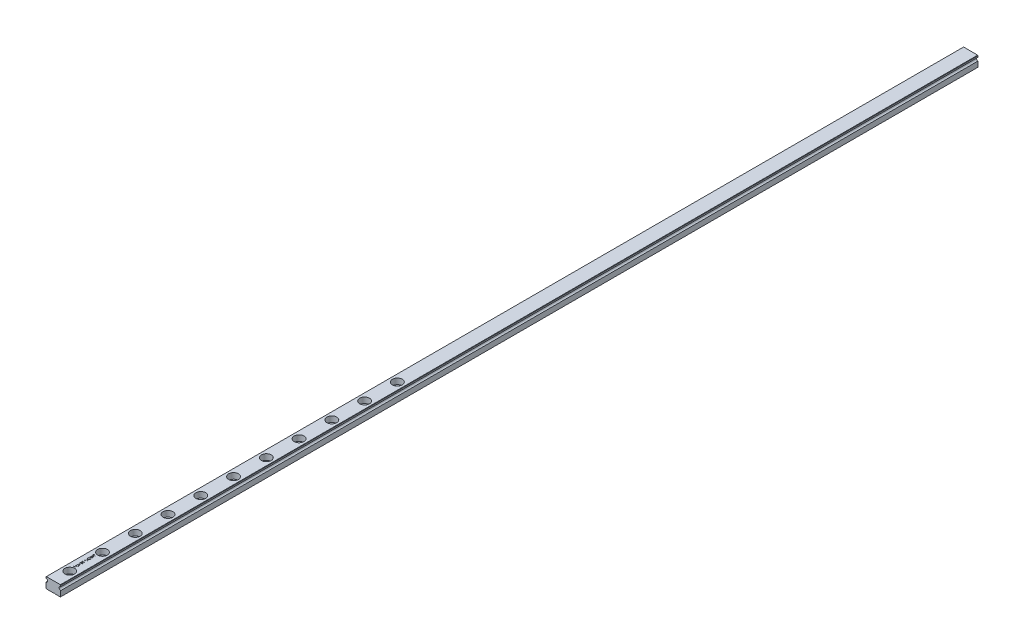
from build123d import *

# Parameters (mm, degrees)
EXTRUDE_1_DEPTH              = 220
HOLE_WIZARD_M3_1_D           = 3.5
HOLE_WIZARD_M3_1_CBORE_D     = 6
HOLE_WIZARD_M3_1_CBORE_DEPTH = 3.5
PATTERN_LINEAR_1_COUNT       = 11
PATTERN_LINEAR_1_PITCH       = 20
SKETCH_6_W                   = 1.5
SKETCH_6_H                   = 0.134615385
CUT_EXTRUDE_1_DEPTH          = 0.1
EXTRUDE_2_DEPTH              = 340


with BuildPart() as part:
    # 草图1 → 凸台-拉伸1 (new body)
    with BuildSketch(Plane.XY):
        with BuildLine():
            Line((4.5, 5.5), (4.5, 6.3))
            Line((4.5, 6.3), (4.3, 6.5))
            Line((4.3, 6.5), (-4.3, 6.5))
            Line((-4.3, 6.5), (-4.5, 6.3))
            Line((-4.5, 6.3), (-4.5, 5.5))
            ThreePointArc((-4.5, 5.5), (-3.5, 4.5), (-4.5, 3.5))
            Line((-4.5, 3.5), (-4.5, 0.2))
            Line((-4.5, 0.2), (-4.3, 0))
            Line((-4.3, 0), (0.2, 0))
            ThreePointArc((0.2, 0), (0.5, 0.3), (0.8, 0))
            Line((0.8, 0), (4.3, 0))
            Line((4.3, 0), (4.5, 0.2))
            Line((4.5, 0.2), (4.5, 3.5))
            ThreePointArc((4.5, 3.5), (3.5, 4.5), (4.5, 5.5))
        make_face()
    extrude(amount=-EXTRUDE_1_DEPTH)

    # M3 六角凹头螺钉的柱形沉头孔1 (through all)
    with Locations(Plane(origin=(0.754900713, 6.5, 19.343475793), x_dir=(-1, 0, 0), z_dir=(0, 1, 0))):
        with Locations((0.754900713, -29.343475793)):
            hole_wizard_m3_1 = CounterBoreHole(HOLE_WIZARD_M3_1_D / 2, HOLE_WIZARD_M3_1_CBORE_D / 2, HOLE_WIZARD_M3_1_CBORE_DEPTH)

    # 阵列(线性)1: M3 六角凹头螺钉的柱形沉头孔1 ×11
    with Locations(*[(0, 0, -i * PATTERN_LINEAR_1_PITCH) for i in range(1, PATTERN_LINEAR_1_COUNT)]):
        add(hole_wizard_m3_1, mode=Mode.SUBTRACT)

    # 草图6 → 切除-拉伸1 (cut)
    # profile 1 of 9: a face of its own
    with BuildSketch(Plane(origin=(0, 6.5, 0), x_dir=(1, 0, 0), z_dir=(0, 1, 0))):
        Polygon((-1.5, 13.740384615), (-1.5, 13.875), (-0.884615385, 13.875), (-0.884615385, 14.644230769), (-1.5, 14.644230769), (-1.5, 14.778846154), (0, 14.778846154), (0, 14.644230769), (-0.730769231, 14.644230769), (-0.730769231, 13.875), (0, 13.875), (0, 13.740384615), align=None)
    # profile 2 of 9: a face of its own
    with BuildSketch(Plane(origin=(0, 6.5, 0), x_dir=(1, 0, 0), z_dir=(0, 1, 0))):
        with Locations((-0.75, 15.230769231)):
            Rectangle(SKETCH_6_W, SKETCH_6_H)
    # profile 3 of 9: a face of its own
    with BuildSketch(Plane(origin=(0, 6.5, 0), x_dir=(1, 0, 0), z_dir=(0, 1, 0))):
        Polygon((-1.5, 15.528846154), (-1.5, 15.66796875), (-0.399939904, 15.961538462), (-1.5, 16.398137019), (-1.5, 16.417668269), (-0.407451923, 16.846153846), (-1.5, 17.141225962), (-1.5, 17.278846154), (0, 16.874399038), (0, 16.855168269), (-1.147235577, 16.403846154), (0, 15.947115385), (0, 15.927884615), align=None)
    # profile 4 of 9: a face of its own
    with BuildSketch(Plane(origin=(0, 6.5, 0), x_dir=(1, 0, 0), z_dir=(0, 1, 0))):
        with Locations((-0.75, 17.692307693)):
            Rectangle(SKETCH_6_W, SKETCH_6_H)
    # profile 5 of 9: a face of its own
    with BuildSketch(Plane(origin=(0, 6.5, 0), x_dir=(1, 0, 0), z_dir=(0, 1, 0))):
        Polygon((0, 18.086538462), (-1.5, 18.086538462), (-1.5, 18.114783654), (-0.319411058, 19.105769231), (-1.5, 19.105769231), (-1.5, 19.240384615), (0, 19.240384615), (0, 19.209735577), (-1.177884615, 18.221153846), (0, 18.221153846), align=None)
    # profile 6 of 9: a face of its own
    with BuildSketch(Plane(origin=(0, 6.5, 0), x_dir=(1, 0, 0), z_dir=(0, 1, 0))):
        Polygon((0, 20.125), (-1.5, 20.323016827), (-1.5, 20.342247596), (-0.269230769, 20.961538462), (-1.5, 21.579326923), (-1.5, 21.598858173), (0, 21.798076923), (0, 21.662860577), (-1.079326923, 21.519230769), (0, 20.977764423), (0, 20.947415865), (-1.081730769, 20.403846154), (0, 20.260516827), align=None)
    # profile 7 of 9: a face of its own
    with BuildSketch(Plane(origin=(0, 6.5, 0), x_dir=(1, 0, 0), z_dir=(0, 1, 0))):
        with BuildLine():
            Line((-1.243990385, 23.509615385), (-1.134615385, 23.394230769))
            add(Edge.make_bspline(
                [(-1.134615385, 23.394230769), (-1.154263766, 23.373355449), (-1.193092001, 23.332102593), (-1.243390317, 23.264731189), (-1.28690443, 23.194721537), (-1.322045397, 23.121960438), (-1.349611823, 23.048355866), (-1.369650093, 22.975173457), (-1.382340162, 22.902887044), (-1.383864341, 22.854816629), (-1.384615385, 22.831129808)],
                knots=[0, 0, 0, 0, 1.089067066, 2.152164705, 3.18986567, 4.218445106, 5.218487318, 6.173592265, 7.100032889, 8, 8, 8, 8], degree=3))
            add(Edge.make_bspline(
                [(-1.384615385, 22.831129808), (-1.384438125, 22.816594936), (-1.384084065, 22.78756289), (-1.379565116, 22.7444392), (-1.373065889, 22.701767784), (-1.363662227, 22.659629195), (-1.351744059, 22.6179415), (-1.336836002, 22.576849691), (-1.319455188, 22.536277104), (-1.299371251, 22.496605953), (-1.277308532, 22.458145638), (-1.252858892, 22.42182164), (-1.226807524, 22.387400299), (-1.198496406, 22.355536353), (-1.168203133, 22.326017847), (-1.136473262, 22.298301833), (-1.102682945, 22.272904871), (-1.066971137, 22.250282454), (-1.030168657, 22.229853485), (-0.992587626, 22.212199685), (-0.954576919, 22.196852561), (-0.915850319, 22.185163721), (-0.876807084, 22.175263346), (-0.837242608, 22.168371388), (-0.797053572, 22.164472967), (-0.770140273, 22.163799899), (-0.756610577, 22.163461538)],
                knots=[0, 0, 0, 0, 1.028150113, 2.053633673, 3.06513288, 4.081487945, 5.106702018, 6.131327874, 7.172780699, 8.228344599, 9.276313556, 10.308389736, 11.324843658, 12.329040066, 13.321460474, 14.316307835, 15.308626991, 16.309440696, 17.305625405, 18.28535951, 19.246194545, 20.203493668, 21.145557131, 22.095268976, 23.042464743, 24, 24, 24, 24], degree=3))
            add(Edge.make_bspline(
                [(-0.756610577, 22.163461538), (-0.742780294, 22.163785622), (-0.715157493, 22.164432905), (-0.673930463, 22.168569989), (-0.633320499, 22.176265079), (-0.593263727, 22.186470115), (-0.553680426, 22.199444118), (-0.514611904, 22.215383767), (-0.476061961, 22.23437211), (-0.438413282, 22.256302653), (-0.401770368, 22.280520997), (-0.36696502, 22.307157219), (-0.334402283, 22.336256163), (-0.303606537, 22.367284281), (-0.274772132, 22.40052428), (-0.248246624, 22.43629865), (-0.223619847, 22.474106619), (-0.201162346, 22.513964957), (-0.181102046, 22.555452377), (-0.163263098, 22.597990847), (-0.14857199, 22.641717091), (-0.136598507, 22.686401091), (-0.126784097, 22.731989638), (-0.120470176, 22.778714125), (-0.115888391, 22.826231), (-0.11555339, 22.858261842), (-0.115384615, 22.874399038)],
                knots=[0, 0, 0, 0, 0.935915162, 1.869274651, 2.799799983, 3.730201895, 4.664668062, 5.616159355, 6.583070886, 7.570012957, 8.562524459, 9.553461134, 10.53281078, 11.515274572, 12.509912756, 13.507571325, 14.526460018, 15.561318395, 16.601025881, 17.643204557, 18.680545676, 19.719612342, 20.772381578, 21.833430283, 22.908478249, 24, 24, 24, 24], degree=3))
            add(Edge.make_bspline(
                [(-0.115384615, 22.874399038), (-0.11579098, 22.893846981), (-0.116588941, 22.932036175), (-0.122805743, 22.988172098), (-0.132502802, 23.042091792), (-0.14674811, 23.093619722), (-0.164779159, 23.142942891), (-0.187077122, 23.189879386), (-0.213407387, 23.234558812), (-0.24323677, 23.276787781), (-0.276471827, 23.315562361), (-0.312015273, 23.350851823), (-0.350327601, 23.381442662), (-0.390837822, 23.408248655), (-0.433933425, 23.430404616), (-0.479374666, 23.448595707), (-0.527189663, 23.462538188), (-0.560228886, 23.468261798), (-0.576923077, 23.471153846)],
                knots=[0, 0, 0, 0, 1.130199668, 2.219330667, 3.279027493, 4.311506524, 5.322739849, 6.327972234, 7.327472899, 8.33386792, 9.329086447, 10.29244429, 11.240784345, 12.174119183, 13.111530729, 14.052100829, 15.015757696, 16, 16, 16, 16], degree=3))
            Line((-0.576923077, 23.471153846), (-0.576923077, 22.971153846))
            Line((-0.576923077, 22.971153846), (-0.730769231, 22.971153846))
            Line((-0.730769231, 22.971153846), (-0.730769231, 23.605769231))
            add(Edge.make_bspline(
                [(-0.730769231, 23.605769231), (-0.702094593, 23.605038153), (-0.645973146, 23.603607301), (-0.564128744, 23.593570623), (-0.48682659, 23.577363547), (-0.413985274, 23.555223413), (-0.34570802, 23.526562579), (-0.281925506, 23.491688638), (-0.223049785, 23.450043443), (-0.168600212, 23.403110397), (-0.12003055, 23.350438986), (-0.077342291, 23.293452435), (-0.041384027, 23.232056591), (-0.012129457, 23.166309531), (0.010702255, 23.096426488), (0.026890073, 23.022245754), (0.036588629, 22.943867925), (0.037827792, 22.890152206), (0.038461538, 22.862680288)],
                knots=[0, 0, 0, 0, 1.140356446, 2.231883559, 3.274166699, 4.278491846, 5.25512956, 6.21435461, 7.1637429, 8.11826594, 9.068280886, 10.0076534, 10.945064095, 11.891975133, 12.864533718, 13.863980011, 14.907571808, 16, 16, 16, 16], degree=3))
            add(Edge.make_bspline(
                [(0.038461538, 22.862680288), (0.038217629, 22.845747373), (0.037736562, 22.812350207), (0.034317699, 22.763025524), (0.029054595, 22.715060829), (0.021106685, 22.668463111), (0.011371833, 22.623060964), (-0.001093904, 22.579081142), (-0.015523346, 22.53635611), (-0.031935778, 22.494819831), (-0.050952202, 22.45484931), (-0.072084905, 22.416266517), (-0.095224917, 22.378858178), (-0.120772422, 22.342879107), (-0.148536333, 22.308141841), (-0.178572299, 22.274870365), (-0.210788493, 22.242878417), (-0.233665211, 22.222838219), (-0.245192308, 22.212740385)],
                knots=[0, 0, 0, 0, 1.107784379, 2.184907829, 3.233506516, 4.263428166, 5.276301166, 6.270063455, 7.25232949, 8.225834625, 9.190232166, 10.146266622, 11.1027726, 12.066435141, 13.031522626, 14.010570082, 14.99756817, 16, 16, 16, 16], degree=3))
            add(Edge.make_bspline(
                [(-0.245192308, 22.212740385), (-0.26347973, 22.198089271), (-0.299751023, 22.169030237), (-0.357865285, 22.131625313), (-0.418037511, 22.099738997), (-0.480435209, 22.073867073), (-0.545000015, 22.053665036), (-0.611649425, 22.039176642), (-0.680469267, 22.030687804), (-0.727040094, 22.02946486), (-0.750600962, 22.028846154)],
                knots=[0, 0, 0, 0, 1.023165419, 2.029347347, 3.013907458, 3.994755782, 4.975994455, 5.96558838, 6.970761222, 8, 8, 8, 8], degree=3))
            add(Edge.make_bspline(
                [(-0.750600962, 22.028846154), (-0.768243641, 22.029074256), (-0.803304773, 22.029527561), (-0.855357904, 22.035024211), (-0.906486775, 22.042910531), (-0.956649576, 22.054502135), (-1.005879862, 22.069114786), (-1.054200296, 22.087352121), (-1.101640133, 22.108585168), (-1.147870041, 22.133266476), (-1.192287019, 22.160724506), (-1.234673706, 22.190556358), (-1.274343142, 22.222992223), (-1.311387223, 22.258126549), (-1.346354989, 22.295251091), (-1.378516018, 22.33514522), (-1.408373576, 22.377204507), (-1.435353952, 22.421754996), (-1.459597318, 22.468093695), (-1.480849352, 22.516119874), (-1.498413761, 22.565816082), (-1.513316774, 22.616810749), (-1.524337558, 22.669489669), (-1.532329875, 22.723470616), (-1.537798704, 22.779034949), (-1.538238528, 22.816593247), (-1.538461538, 22.835637019)],
                knots=[0, 0, 0, 0, 1.00895651, 2.005089799, 2.991467152, 3.967318338, 4.948153826, 5.927364234, 6.919980553, 7.91976625, 8.923240147, 9.905815003, 10.88314567, 11.851989312, 12.825009789, 13.798721852, 14.781296708, 15.773896486, 16.776076962, 17.771600213, 18.775744723, 19.78957137, 20.808953803, 21.851964491, 22.910847925, 24, 24, 24, 24], degree=3))
            add(Edge.make_bspline(
                [(-1.538461538, 22.835637019), (-1.538213185, 22.851167695), (-1.537720729, 22.8819632), (-1.534307308, 22.927788514), (-1.528897073, 22.97290552), (-1.521514165, 23.017381116), (-1.511458298, 23.061063844), (-1.499424747, 23.104078147), (-1.485413966, 23.146486377), (-1.46870446, 23.188155626), (-1.449738621, 23.229366076), (-1.428390011, 23.270346865), (-1.404293581, 23.31095797), (-1.37737778, 23.351269819), (-1.348104887, 23.391536616), (-1.315637676, 23.431121462), (-1.281256495, 23.470979867), (-1.256535559, 23.496609216), (-1.243990385, 23.509615385)],
                knots=[0, 0, 0, 0, 0.985871117, 1.954866573, 2.915460327, 3.869826059, 4.81536089, 5.759505086, 6.70452669, 7.649098992, 8.607881297, 9.583363685, 10.581137262, 11.603961102, 12.659522466, 13.73993555, 14.853081303, 16, 16, 16, 16], degree=3))
        make_face()
    # profile 8 of 9: a face of its own
    with BuildSketch(Plane(origin=(0, 6.5, 0), x_dir=(1, 0, 0), z_dir=(0, 1, 0))):
        Polygon((0, 23.913461538), (-1.5, 23.913461538), (-1.5, 23.941706731), (-0.319411058, 24.932692308), (-1.5, 24.932692308), (-1.5, 25.067307692), (0, 25.067307692), (0, 25.036658654), (-1.177884615, 24.048076923), (0, 24.048076923), align=None)
    # profile 9 of 9: a face of its own
    with BuildSketch(Plane(origin=(0, 6.5, 0), x_dir=(1, 0, 0), z_dir=(0, 1, 0))):
        with BuildLine():
            Line((0.038461538, 25.644230769), (-0.036358173, 25.536658654))
            Line((-0.036358173, 25.536658654), (-0.646033654, 25.953725962))
            add(Edge.make_bspline(
                [(-0.646033654, 25.953725962), (-0.642627639, 25.927119325), (-0.635922786, 25.874743285), (-0.635046516, 25.821948826), (-0.634615385, 25.795973558)],
                knots=[0, 0, 0, 0, 1.015985029, 2, 2, 2, 2], degree=3))
            add(Edge.make_bspline(
                [(-0.634615385, 25.795973558), (-0.635018703, 25.780226966), (-0.635810382, 25.749317783), (-0.642085443, 25.703875646), (-0.651749784, 25.660210407), (-0.666170676, 25.61843782), (-0.684092777, 25.578400913), (-0.706317169, 25.540186946), (-0.732462883, 25.503847908), (-0.762390698, 25.469771994), (-0.79525498, 25.438786105), (-0.830027824, 25.411158608), (-0.867084601, 25.38832306), (-0.905643777, 25.369014905), (-0.946528356, 25.354782526), (-0.989044603, 25.344167996), (-1.033456433, 25.33770465), (-1.063680548, 25.336931181), (-1.079026442, 25.336538462)],
                knots=[0, 0, 0, 0, 1.060698949, 2.082059282, 3.085738422, 4.069684654, 5.054463875, 6.037298355, 7.043153692, 8.066652628, 9.088369706, 10.083456696, 11.053578809, 12.016466116, 12.983507685, 13.964045196, 14.966270913, 16, 16, 16, 16], degree=3))
            add(Edge.make_bspline(
                [(-1.079026442, 25.336538462), (-1.100012199, 25.337283285), (-1.141202981, 25.338745222), (-1.201400397, 25.350466182), (-1.258351131, 25.369885651), (-1.3119915, 25.396537862), (-1.361089385, 25.43075081), (-1.405478439, 25.47138122), (-1.444366827, 25.518757479), (-1.477757084, 25.571642671), (-1.504794475, 25.628718475), (-1.524003389, 25.688742519), (-1.536274492, 25.750703662), (-1.537729379, 25.792811829), (-1.538461538, 25.814002404)],
                knots=[0, 0, 0, 0, 1.023011052, 2.007963168, 2.978169221, 3.950402619, 4.919353283, 5.887490769, 6.876420893, 7.899700203, 8.931203047, 9.947778163, 10.96723692, 12, 12, 12, 12], degree=3))
            add(Edge.make_bspline(
                [(-1.538461538, 25.814002404), (-1.537677179, 25.834783148), (-1.536127357, 25.875843941), (-1.524777147, 25.936225043), (-1.505646911, 25.994056533), (-1.479211547, 26.04902008), (-1.446070758, 26.099903164), (-1.406596454, 26.145683388), (-1.360755672, 26.185145911), (-1.309807647, 26.21879079), (-1.25472961, 26.245295182), (-1.197347446, 26.264716171), (-1.138006313, 26.276587527), (-1.097810064, 26.2780886), (-1.077524038, 26.278846154)],
                knots=[0, 0, 0, 0, 1.026358223, 2.027987109, 3.023239252, 4.028077889, 5.032770297, 6.015020143, 7.004250571, 8.011656937, 9.02310243, 10.015224881, 10.998334443, 12, 12, 12, 12], degree=3))
            add(Edge.make_bspline(
                [(-1.077524038, 26.278846154), (-1.061777289, 26.278338872), (-1.029838946, 26.277309978), (-0.981399024, 26.270187018), (-0.932048608, 26.257900384), (-0.890237555, 26.244171772), (-0.855599349, 26.230715419), (-0.828157364, 26.218414328), (-0.799474135, 26.204124912), (-0.769432207, 26.188166246), (-0.737992383, 26.170568563), (-0.705372722, 26.150853478), (-0.671525668, 26.129286907), (-0.648704972, 26.113932306), (-0.637019231, 26.106069712)],
                knots=[0, 0, 0, 0, 1.179894106, 2.393120058, 3.660107319, 4.986885617, 5.687958251, 6.443931318, 7.239444731, 8.088894906, 8.992865148, 9.938946712, 10.944601238, 12, 12, 12, 12], degree=3))
            Line((-0.637019231, 26.106069712), (0.038461538, 25.644230769))
        make_face()
        with BuildLine():
            add(Edge.make_bspline(
                [(-0.788461538, 25.820913462), (-0.788788092, 25.832842038), (-0.789423782, 25.856062922), (-0.793275522, 25.890085737), (-0.800155229, 25.922181807), (-0.809870336, 25.952557703), (-0.822177437, 25.981176653), (-0.837175655, 26.008047671), (-0.855193568, 26.032896281), (-0.875446063, 26.05581095), (-0.897641992, 26.076606708), (-0.92142287, 26.094537445), (-0.946049906, 26.110062218), (-0.972027251, 26.122447516), (-0.998929945, 26.132428799), (-1.027147055, 26.139393389), (-1.056483756, 26.143240028), (-1.076411522, 26.143896939), (-1.086538462, 26.144230769)],
                knots=[0, 0, 0, 0, 1.163726718, 2.265380301, 3.334713825, 4.36057981, 5.371541381, 6.368955992, 7.355979581, 8.359691305, 9.348261197, 10.317521986, 11.261029684, 12.183096459, 13.119698615, 14.055740009, 15.011961376, 16, 16, 16, 16], degree=3))
            add(Edge.make_bspline(
                [(-1.086538462, 26.144230769), (-1.096669885, 26.143944046), (-1.116635099, 26.143379024), (-1.146011565, 26.138837612), (-1.174173238, 26.130870253), (-1.201311834, 26.120071794), (-1.227278993, 26.10611642), (-1.252156559, 26.089207568), (-1.27556797, 26.06878977), (-1.297899065, 26.04597379), (-1.318157147, 26.020878942), (-1.336055672, 25.994290795), (-1.351161049, 25.966351386), (-1.363089133, 25.93693608), (-1.37286104, 25.906444325), (-1.379778661, 25.87456046), (-1.383632614, 25.841240421), (-1.384283622, 25.818619358), (-1.384615385, 25.807091346)],
                knots=[0, 0, 0, 0, 0.971910406, 1.91526867, 2.84337505, 3.775008003, 4.712374136, 5.666733183, 6.654995996, 7.688089235, 8.726800303, 9.745078658, 10.75990398, 11.768337501, 12.786615857, 13.829099629, 14.893678693, 16, 16, 16, 16], degree=3))
            add(Edge.make_bspline(
                [(-1.384615385, 25.807091346), (-1.384283077, 25.795663594), (-1.383631091, 25.773242439), (-1.379786064, 25.740218598), (-1.372814047, 25.708550372), (-1.363093561, 25.678147127), (-1.351160136, 25.648732673), (-1.336054875, 25.620794582), (-1.318161301, 25.594200241), (-1.297882935, 25.569129265), (-1.275672102, 25.546272163), (-1.252051947, 25.526199864), (-1.227292163, 25.509252774), (-1.201308356, 25.495316895), (-1.174174163, 25.48451328), (-1.146011315, 25.476547297), (-1.116635164, 25.472005515), (-1.096669907, 25.471440543), (-1.086538462, 25.471153846)],
                knots=[0, 0, 0, 0, 1.099107991, 2.156440826, 3.191784126, 4.212280276, 5.222910149, 6.239945746, 7.260441896, 8.30141526, 9.33675856, 10.320924759, 11.277362386, 12.216770088, 13.150432123, 14.080559904, 15.025972789, 16, 16, 16, 16], degree=3))
            add(Edge.make_bspline(
                [(-1.086538462, 25.471153846), (-1.076403667, 25.471413811), (-1.056415996, 25.471926509), (-1.02704542, 25.476862927), (-0.998901248, 25.485140198), (-0.971743232, 25.496115903), (-0.945922725, 25.510845615), (-0.921305837, 25.528746476), (-0.897389308, 25.549401013), (-0.875515463, 25.573486122), (-0.855096635, 25.599349364), (-0.837288944, 25.627129241), (-0.822356647, 25.656267501), (-0.809834058, 25.686577057), (-0.800253227, 25.718284705), (-0.793288301, 25.751346293), (-0.789460709, 25.785767775), (-0.788797791, 25.809085836), (-0.788461538, 25.820913462)],
                knots=[0, 0, 0, 0, 0.952872936, 1.879239831, 2.791748947, 3.708674669, 4.628500839, 5.580394867, 6.568761142, 7.595635223, 8.636123962, 9.665976811, 10.694276597, 11.712685318, 12.747011694, 13.805940053, 14.887106426, 16, 16, 16, 16], degree=3))
        make_face(mode=Mode.SUBTRACT)
    extrude(amount=-CUT_EXTRUDE_1_DEPTH, mode=Mode.SUBTRACT)

    # 草图7 → 凸台-拉伸2 (add)
    with BuildSketch(Plane(origin=(0, 0, -220), x_dir=(-1, 0, 0), z_dir=(0, 0, -1))):
        with BuildLine():
            Line((-4.3, 0), (-0.8, 0))
            ThreePointArc((-0.8, 0), (-0.5, 0.3), (-0.2, 0))
            Line((-0.2, 0), (4.3, 0))
            Line((4.3, 0), (4.5, 0.2))
            Line((4.5, 0.2), (4.5, 3.5))
            ThreePointArc((4.5, 3.5), (3.5, 4.5), (4.5, 5.5))
            Line((4.5, 5.5), (4.5, 6.3))
            Line((4.5, 6.3), (4.3, 6.5))
            Line((4.3, 6.5), (-4.3, 6.5))
            Line((-4.3, 6.5), (-4.5, 6.3))
            Line((-4.5, 6.3), (-4.5, 5.5))
            ThreePointArc((-4.5, 5.5), (-3.5, 4.5), (-4.5, 3.5))
            Line((-4.5, 3.5), (-4.5, 0.2))
            Line((-4.5, 0.2), (-4.3, 0))
        make_face()
    extrude(amount=EXTRUDE_2_DEPTH)


solid = part.part
